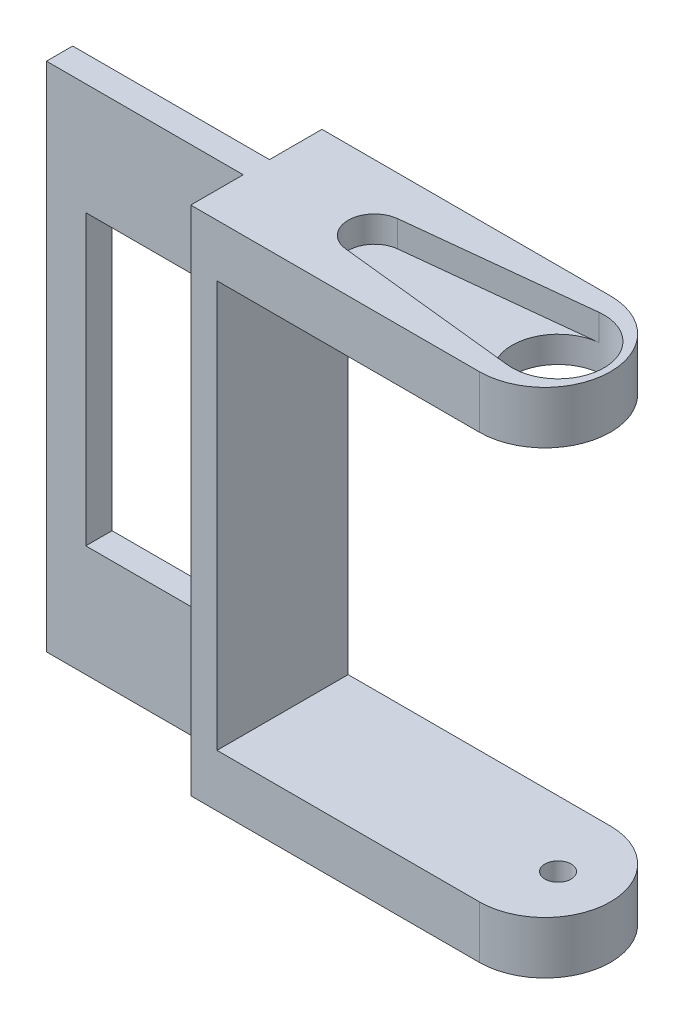
from build123d import *
from build123d.topology import SkipClean

# Parameters (mm, degrees)
BOSS_EXTRUDE1_DEPTH = 10
SKETCH2_W           = 15
SKETCH2_H           = 2
BOSS_EXTRUDE2_DEPTH = 39
FILLET1_RADIUS      = 5
FILLET1_LENGTH      = 4
FILLET2_RADIUS      = 5
FILLET2_LENGTH      = 4
SKETCH6_R           = 1
CUT_EXTRUDE3_DEPTH  = 43
CUT_EXTRUDE4_DEPTH  = 2
SKETCH9_R           = 3.5
CUT_EXTRUDE5_DEPTH  = 8
SKETCH10_W          = 12
SKETCH10_H          = 22
CUT_EXTRUDE6_DEPTH  = 5


with BuildPart() as part:
    # Sketch1 → Boss-Extrude1 (new body)
    with BuildSketch(Plane.XY):
        Polygon((-27, 17.343669269), (0, 17.343669269), (0, 13.343669269), (-25, 13.343669269), (-25, -17.656330731), (0, -17.656330731), (0, -21.656330731), (-27, -21.656330731), align=None)
    extrude(amount=BOSS_EXTRUDE1_DEPTH)

    # Sketch2 → Boss-Extrude2 (add)
    with BuildSketch(Plane(origin=(0, 17.343669269, 0), x_dir=(1, 0, 0), z_dir=(0, 1, 0))):
        with Locations((-34.5, -5)):
            Rectangle(SKETCH2_W, SKETCH2_H)
    extrude(amount=-BOSS_EXTRUDE2_DEPTH)

    # Fillet1: full round fillet: the end face becomes a half cylinder, R = half its width
    fillet1_face = Plane((0, 15.343669269, 5), x_dir=(0, -1, 0), z_dir=(1, 0, 0))  # on the end face: x along it, z out of the body
    fillet1_slab = fillet1_face.offset(-FILLET1_RADIUS / 2) * Box(FILLET1_LENGTH, 2 * FILLET1_RADIUS, FILLET1_RADIUS, mode=Mode.PRIVATE)  # the body's end, R deep
    fillet1_round = Plane((-5, 15.343669269, 5), x_dir=(1, 0, 0), z_dir=(0, -1, 0)) * Cylinder(FILLET1_RADIUS, FILLET1_LENGTH, mode=Mode.PRIVATE)  # its axis R under the face
    add(fillet1_slab - fillet1_round, mode=Mode.SUBTRACT)

    # Fillet2: full round fillet: the end face becomes a half cylinder, R = half its width
    fillet2_face = Plane((0, -19.656330731, 5), x_dir=(0, 1, 0), z_dir=(1, 0, 0))  # on the end face: x along it, z out of the body
    fillet2_slab = fillet2_face.offset(-FILLET2_RADIUS / 2) * Box(FILLET2_LENGTH, 2 * FILLET2_RADIUS, FILLET2_RADIUS, mode=Mode.PRIVATE)  # the body's end, R deep
    fillet2_round = Plane((-5, -19.656330731, 5), x_dir=(1, 0, 0), z_dir=(0, 1, 0)) * Cylinder(FILLET2_RADIUS, FILLET2_LENGTH, mode=Mode.PRIVATE)  # its axis R under the face
    add(fillet2_slab - fillet2_round, mode=Mode.SUBTRACT)

    # Sketch6 → Cut-Extrude3 (cut)
    with BuildSketch(Plane(origin=(0, 17.343669269, 0), x_dir=(1, 0, 0), z_dir=(0, 1, 0))):
        with Locations(Location((-4, -5, 0), (0, 0, 270))):
            Circle(SKETCH6_R)
    extrude(amount=-CUT_EXTRUDE3_DEPTH, mode=Mode.SUBTRACT)

    # Sketch8 → Cut-Extrude4 (cut)
    with BuildSketch(Plane(origin=(0, 17.343669269, 0), x_dir=(1, 0, 0), z_dir=(0, 1, 0))):
        with BuildLine():
            Line((-18.214285714, -3.011512728), (-4.375, -1.520147273))
            ThreePointArc((-4.375, -1.520147273), (-0.5, -5), (-4.375, -8.479852727))
            Line((-4.375, -8.479852727), (-18.214285714, -6.988487272))
            ThreePointArc((-18.214285714, -6.988487272), (-20, -5), (-18.214285714, -3.011512728))
        make_face()
    extrude(amount=-CUT_EXTRUDE4_DEPTH, mode=Mode.SUBTRACT)

    # Sketch9 → Cut-Extrude5 (cut)
    with SkipClean():  # the faces are left unmerged after this step: merging them gives an invalid solid
        with BuildSketch(Plane(origin=(0, 17.343669269, 0), x_dir=(1, 0, 0), z_dir=(0, 1, 0))):
            with Locations(Location((-4, -5, 0), (0, 0, 263.849360172))):
                Circle(SKETCH9_R)
        extrude(amount=-CUT_EXTRUDE5_DEPTH, mode=Mode.SUBTRACT)

    # Sketch10 → Cut-Extrude6 (cut)
    with SkipClean():  # the faces are left unmerged after this step: merging them gives an invalid solid
        with BuildSketch(Plane.XY.offset(6)):
            with Locations((-33, -2.156330731)):
                Rectangle(SKETCH10_W, SKETCH10_H)
        extrude(amount=-CUT_EXTRUDE6_DEPTH, mode=Mode.SUBTRACT)


solid = part.part
